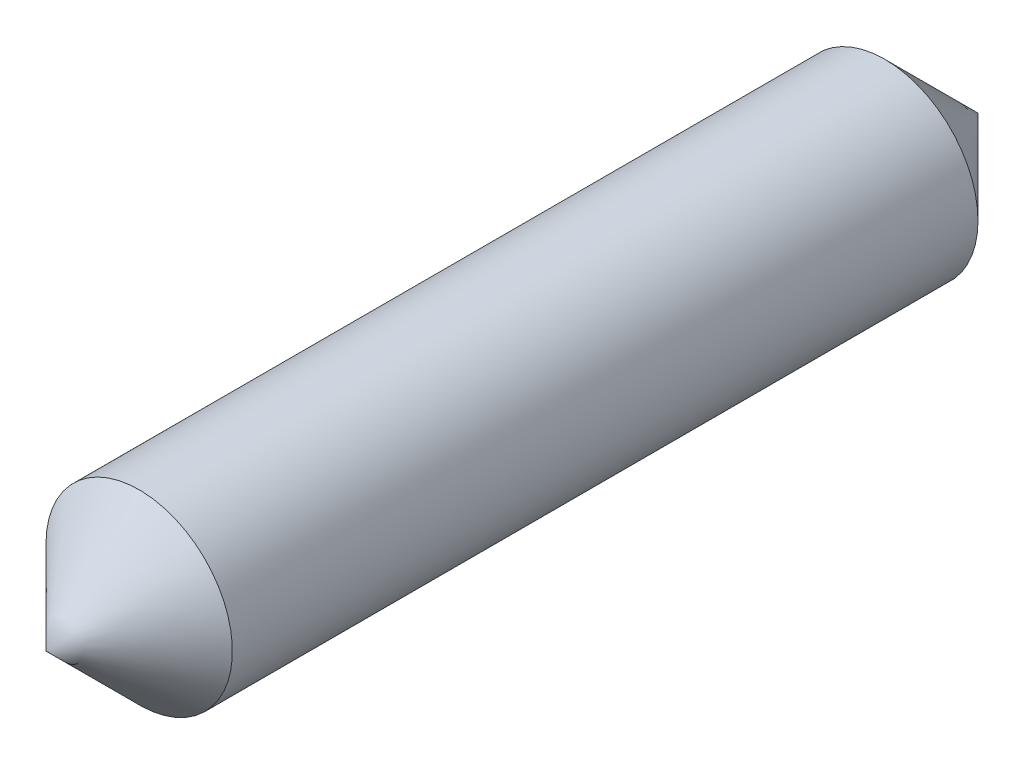
from build123d import *


with BuildPart() as part:
    # Sketch4 → Revolve2 (revolve)
    with BuildSketch(Plane(origin=(0, 0, 0), x_dir=(1, 0, 0), z_dir=(0, 1, 0)), mode=Mode.PRIVATE) as revolve2_sk:
        Polygon((0, 50), (0, -50), (10, -40), (10, 40), align=None)
    revolve(revolve2_sk.sketch.rotate(Axis((0, 0, -50), (0, 0, 1)), 180), axis=Axis((0, 0, -50), (0, 0, 1)))


solid = part.part
